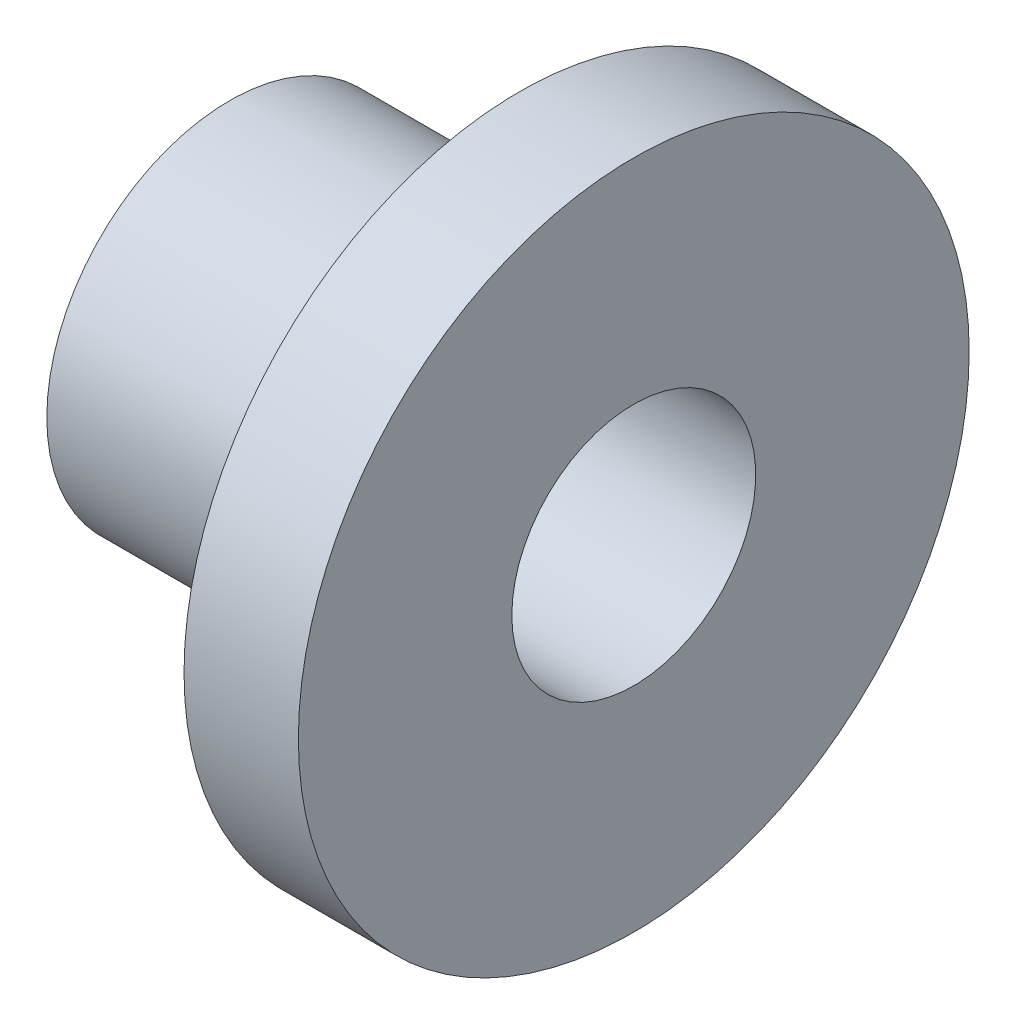
from build123d import *


with BuildPart() as part:
    # 草图1 → 旋转1 (revolve)
    with BuildSketch(Plane.XY, mode=Mode.PRIVATE) as revolve_1_sk:
        Polygon((0, 1.6), (0, 2.4), (3.8, 2.4), (3.8, 4.4), (5.3, 4.4), (5.3, 1.6), align=None)
    revolve(revolve_1_sk.sketch.rotate(Axis((0, 0, 0), (1, 0, 0)), 90), axis=Axis((0, 0, 0), (1, 0, 0)))


solid = part.part
